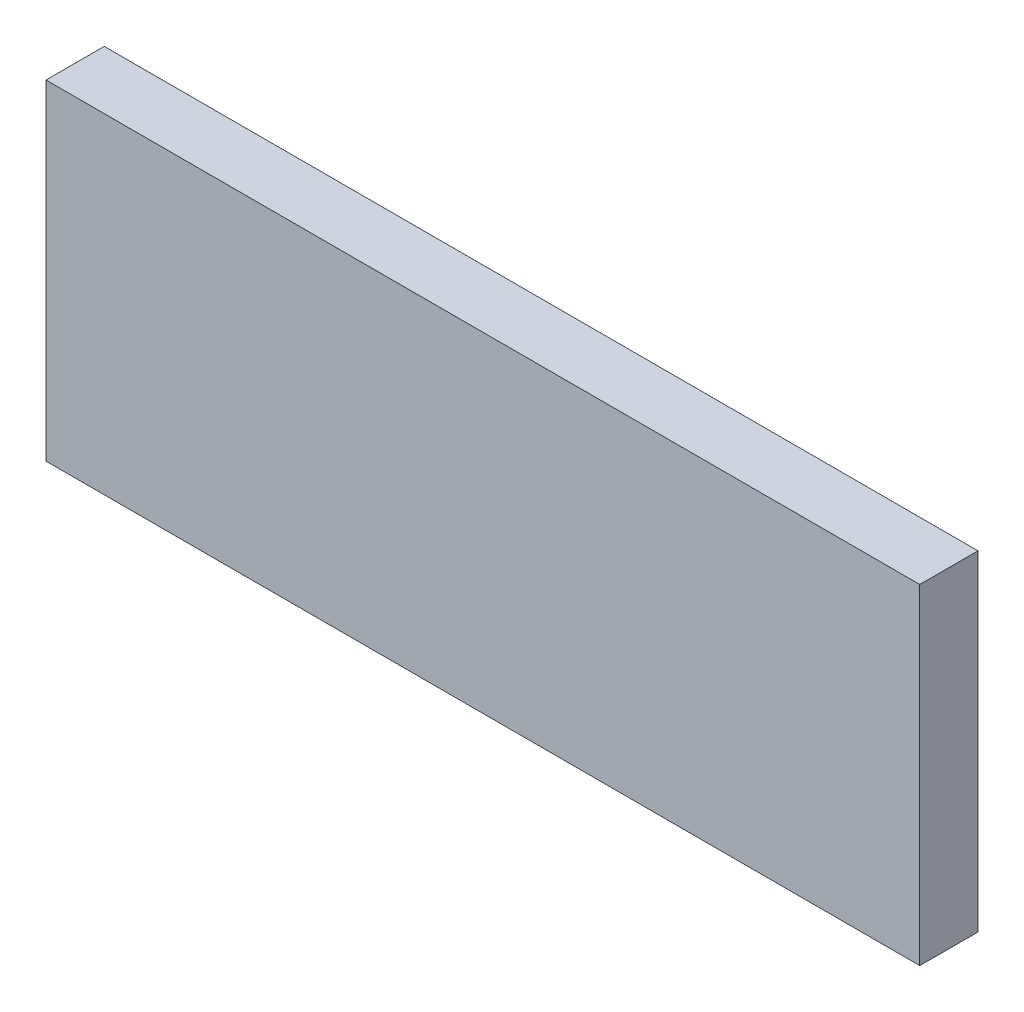
from build123d import *

# Parameters (mm, degrees)
SKETCH2_W           = 4500
SKETCH2_H           = 1700
BOSS_EXTRUDE1_DEPTH = 300
SHELL1_T            = 50


with BuildPart() as part:
    # Sketch2 → Boss-Extrude1 (new body)
    with BuildSketch(Plane.XY):
        with Locations((2250, 850)):
            Rectangle(SKETCH2_W, SKETCH2_H)
    extrude(amount=BOSS_EXTRUDE1_DEPTH)

    # Shell1 (no face opened: a closed hollow body)
    add(offset(amount=-SHELL1_T, mode=Mode.PRIVATE), mode=Mode.SUBTRACT)


solid = part.part
